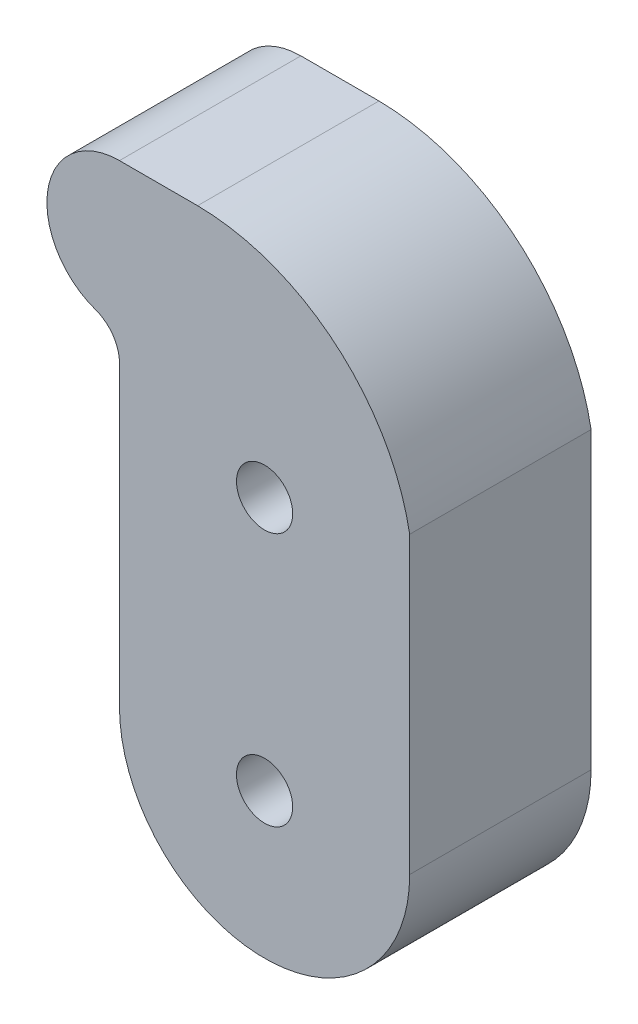
from build123d import *

# Parameters (mm, degrees)
SZKIC1_R                    = 1.55
DODANIE_WYCI_GNI_CIE1_DEPTH = 10


with BuildPart() as part:
    # Szkic1 → Dodanie-wyciągnięcie1 (new body)
    with BuildSketch(Plane.XY):
        with BuildLine():
            Line((-179.126801066, 83.617157096), (-183.434880274, 83.617157096))
            ThreePointArc((-183.434880274, 83.617157096), (-187.377274513, 80.293565011), (-184.768213607, 75.84592093))
            ThreePointArc((-184.768213607, 75.84592093), (-183.801887112, 75.115003385), (-183.434880274, 73.960302847))
            Line((-183.434880274, 73.960302847), (-183.434880274, 57.530770571))
            ThreePointArc((-183.434880274, 57.530770571), (-175.434880274, 49.530770571), (-167.434880274, 57.530770571))
            Line((-167.434880274, 57.530770571), (-167.434880274, 73.777889147))
            ThreePointArc((-167.434880274, 73.777889147), (-171.51222692, 80.799152225), (-179.126801066, 83.617157096))
        make_face()
        with Locations((-175.434880274, 57.530770571)):
            Circle(SZKIC1_R, mode=Mode.SUBTRACT)
        with Locations((-175.434880274, 71.530770571)):
            Circle(SZKIC1_R, mode=Mode.SUBTRACT)
    extrude(amount=DODANIE_WYCI_GNI_CIE1_DEPTH)


solid = part.part
